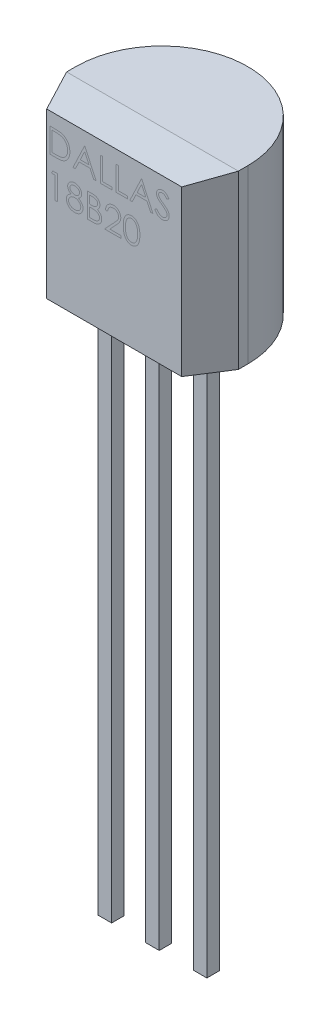
from build123d import *

# Parameters (mm, degrees)
BOSS_EXTRUDE1_DEPTH = 4.58
SKETCH4_W           = 0.36
SKETCH4_H           = 0.33
BOSS_EXTRUDE2_DEPTH = 14.47
SKETCH7_R           = 0.763333333
CUT_EXTRUDE1_DEPTH  = 0.25


with BuildPart() as part:
    # Sketch1 → Boss-Extrude1 (new body)
    with BuildSketch(Plane(origin=(0, 0, 0), x_dir=(1, 0, 0), z_dir=(0, 1, 0))):
        with BuildLine():
            Line((-2.29, 0), (-2.29, -0.25))
            Line((-2.29, -0.25), (2.29, -0.25))
            Line((2.29, -0.25), (2.29, 0))
            ThreePointArc((2.29, 0), (0, 2.29), (-2.29, 0))
        make_face()
    extrude(amount=BOSS_EXTRUDE1_DEPTH)

    # Sketch2 → Loft1 section 0
    with BuildSketch(Plane.XY.offset(0.25)):
        with BuildLine():
            Line((-2.29, 0), (2.29, 0))
            Line((2.29, 0), (2.29, 4.58))
            Line((2.29, 4.58), (-2.29, 4.58))
            Line((-2.29, 4.58), (-2.29, 0))
        make_face()
    # Sketch3 → Loft1 section 1
    with BuildSketch(Plane.XY.offset(1.27)):
        with BuildLine():
            Line((-1.8, 0.1), (1.8, 0.1))
            Line((1.8, 0.1), (1.8, 4.48))
            Line((1.8, 4.48), (-1.8, 4.48))
            Line((-1.8, 4.48), (-1.8, 0.1))
        make_face()
    loft()

    # Sketch4 → Boss-Extrude2 (add)
    with BuildSketch(Plane.XZ):
        with Locations((0, 0.085)):
            Rectangle(SKETCH4_W, SKETCH4_H)
        with Locations((-1.27, 0.085)):
            Rectangle(SKETCH4_W, SKETCH4_H)
        with Locations((1.27, 0.085)):
            Rectangle(SKETCH4_W, SKETCH4_H)
    extrude(amount=BOSS_EXTRUDE2_DEPTH)

    # Sketch7 → Cut-Extrude1 (cut)
    with BuildSketch(Plane.XY.offset(-2.29)):
        with Locations(Location((0, 2.29, 0), (0, 0, 180))):
            Circle(SKETCH7_R)
    extrude(amount=CUT_EXTRUDE1_DEPTH, mode=Mode.SUBTRACT)


solid = part.part
